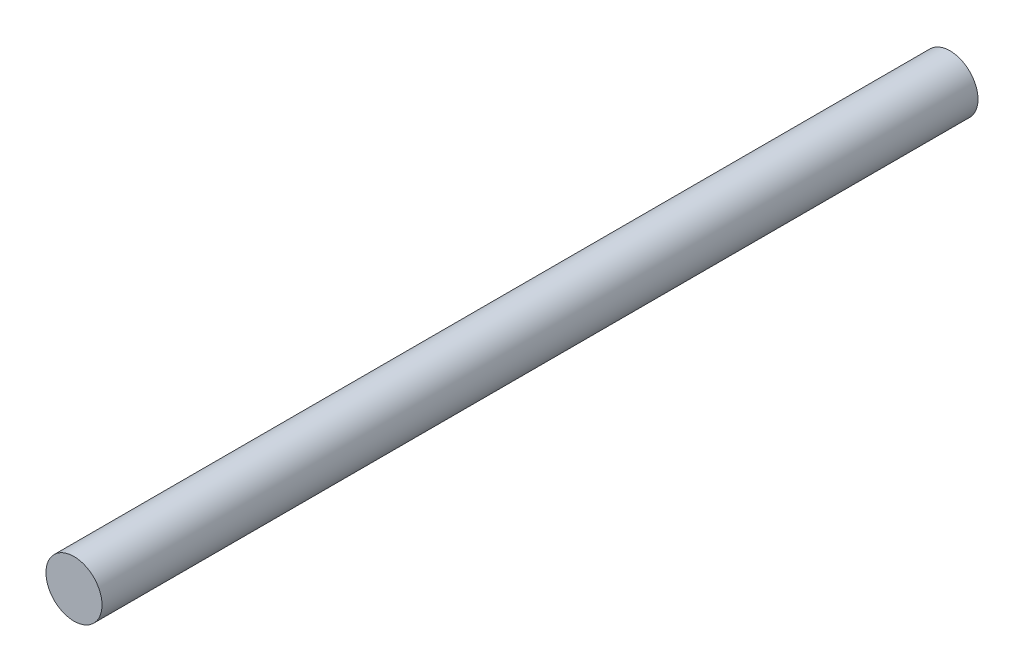
from build123d import *

# Parameters (mm, degrees)
SKETCH_1_R      = 1.6
EXTRUDE_1_DEPTH = 50


with BuildPart() as part:
    # 草圖1 → 填料-伸長1 (new body)
    with BuildSketch(Plane.XY):
        Circle(SKETCH_1_R)
    extrude(amount=EXTRUDE_1_DEPTH)


solid = part.part
